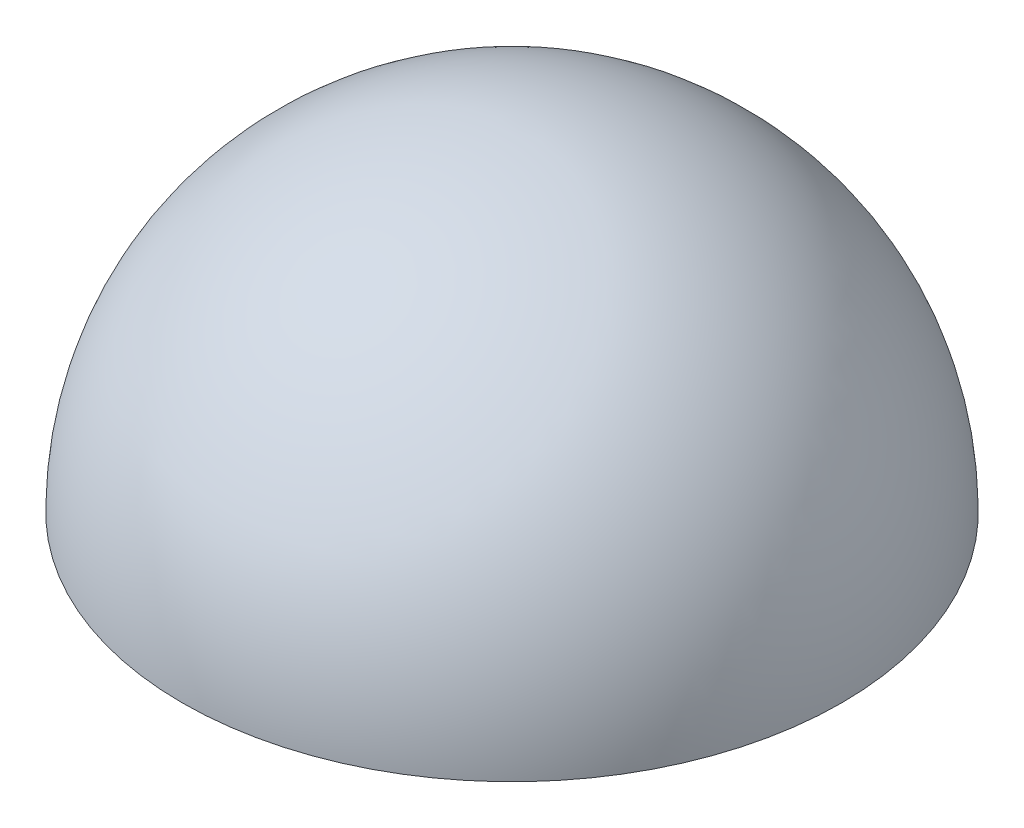
from build123d import *


with BuildPart() as part:
    # Sketch1 → Revolve3 (revolve)
    with BuildSketch(Plane.XY):
        with BuildLine():
            Line((25.4, 0), (22.86, 0))
            ThreePointArc((22.86, 0), (16.164461018, 16.164461018), (0, 22.86))
            Line((0, 22.86), (0, 25.4))
            ThreePointArc((0, 25.4), (17.960512242, 17.960512242), (25.4, 0))
        make_face()
    revolve(axis=Axis((0, 26.67, 0), (0, -1, 0)))


solid = part.part
